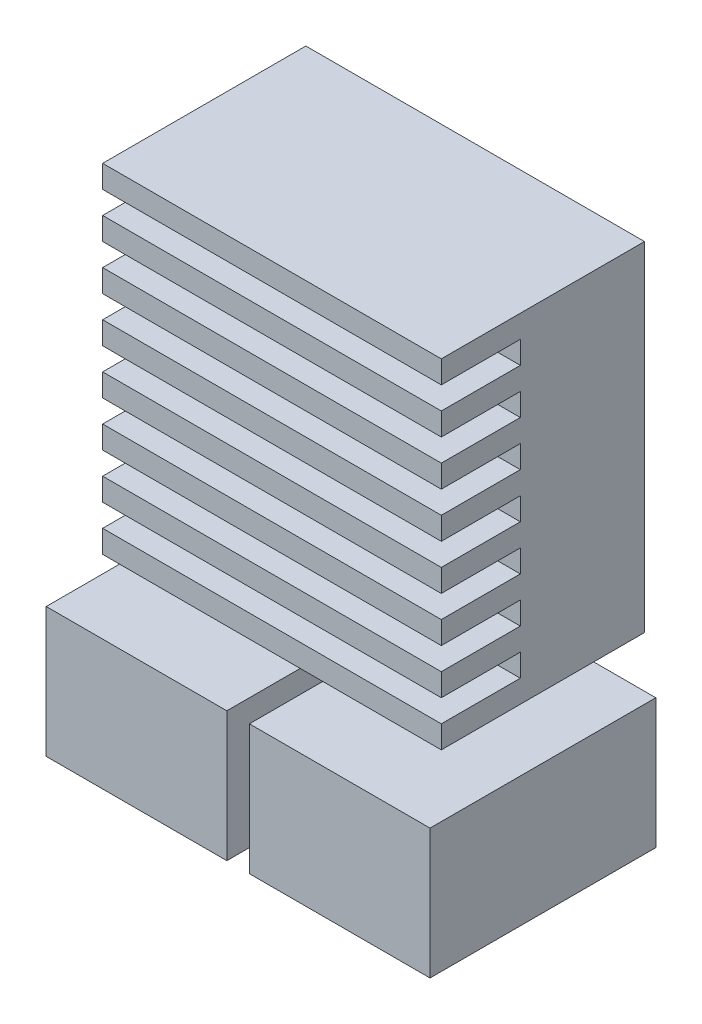
from build123d import *

# Parameters (mm, degrees)
SKICA1_W                 = 30
SKICA1_H                 = 30
SKICA1_R                 = 1.5
P_IDAT_VYSUNUT_M1_DEPTH  = 7
SKICA2_W                 = 30
SKICA2_H                 = 30
P_IDAT_VYSUNUT_M2_DEPTH  = 11
SKICA3_W                 = 7
SKICA3_H                 = 2
ODEBRAT_VYSUNUT_M1_DEPTH = 30
SKICA4_R                 = 1.5
P_IDAT_VYSUNUT_M3_DEPTH  = 3.5
SKICA5_W                 = 16
SKICA5_H                 = 20
P_IDAT_VYSUNUT_M4_DEPTH  = 11.5
P_IDAT_VYSUNUT_M5_DEPTH  = 6.5
ZKOSEN_1_SIZE            = 3


with BuildPart() as part:
    # Skica1 → Přidat vysunutím1 (new body)
    with BuildSketch(Plane.XY):
        Rectangle(SKICA1_W, SKICA1_H)
        with Locations((5, 5)):
            Circle(SKICA1_R, mode=Mode.SUBTRACT)
        with Locations((-5, 5)):
            Circle(SKICA1_R, mode=Mode.SUBTRACT)
        with Locations((0, -5)):
            Circle(SKICA1_R, mode=Mode.SUBTRACT)
    extrude(amount=P_IDAT_VYSUNUT_M1_DEPTH)

    # Skica2 → Přidat vysunutím2 (add)
    with BuildSketch(Plane.XY.offset(7)):
        Rectangle(SKICA2_W, SKICA2_H)
    extrude(amount=P_IDAT_VYSUNUT_M2_DEPTH)

    # Skica3 → Odebrat vysunutím1 (cut)
    with BuildSketch(Plane(origin=(15, 0, 0), x_dir=(0, 0, -1), z_dir=(1, 0, 0))):
        with Locations((-14.5, 12)):
            Rectangle(SKICA3_W, SKICA3_H)
        with Locations((-14.5, 8)):
            Rectangle(SKICA3_W, SKICA3_H)
        with Locations((-14.5, 4)):
            Rectangle(SKICA3_W, SKICA3_H)
        with Locations((-14.5, 0)):
            Rectangle(SKICA3_W, SKICA3_H)
        with Locations((-14.5, -4)):
            Rectangle(SKICA3_W, SKICA3_H)
        with Locations((-14.5, -8)):
            Rectangle(SKICA3_W, SKICA3_H)
        with Locations((-14.5, -12)):
            Rectangle(SKICA3_W, SKICA3_H)
    extrude(amount=-ODEBRAT_VYSUNUT_M1_DEPTH, mode=Mode.SUBTRACT)

    # Skica4 → Přidat vysunutím3 (add)
    with BuildSketch(Plane.XZ.offset(15)):
        with Locations(Location((9, 6, 0), (0, 0, 180))):
            Circle(SKICA4_R)
        with Locations(Location((-9, 6, 0), (0, 0, 180))):
            Circle(SKICA4_R)
    extrude(amount=P_IDAT_VYSUNUT_M3_DEPTH)

    # Skica5 → Přidat vysunutím4 (add)
    with BuildSketch(Plane.XZ.offset(18.5)):
        with Locations((9, 11)):
            Rectangle(SKICA5_W, SKICA5_H)
        with Locations((-9, 11)):
            Rectangle(SKICA5_W, SKICA5_H)
    extrude(amount=P_IDAT_VYSUNUT_M4_DEPTH)

    # Skica6 → Přidat vysunutím5 (add)
    with BuildSketch(Plane.XZ.offset(30)):
        Polygon((-4.958548116, 6), (-6.979274058, 9.5), (-11.020725942, 9.5), (-13.041451884, 6), (-11.020725942, 2.5), (-6.979274058, 2.5), align=None)
        Polygon((6.979274058, 2.5), (4.958548116, 6), (6.979274058, 9.5), (11.020725942, 9.5), (13.041451884, 6), (11.020725942, 2.5), align=None)
    extrude(amount=P_IDAT_VYSUNUT_M5_DEPTH)

    # Zkosení1
    zkosen_1_edges = [part.edges().sort_by_distance(p)[0] for p in [
        (-5.968911087, -36.5, 4.25),
        (-5.968911087, -36.5, 7.75),
        (-9, -36.5, 9.5),
        (-12.031088913, -36.5, 7.75),
        (-12.031088913, -36.5, 4.25),
        (-9, -36.5, 2.5),
        (9, -36.5, 2.5),
        (12.031088913, -36.5, 4.25),
        (12.031088913, -36.5, 7.75),
        (9, -36.5, 9.5),
        (5.968911087, -36.5, 7.75),
        (5.968911087, -36.5, 4.25),
    ]]
    chamfer(zkosen_1_edges, length=ZKOSEN_1_SIZE)


solid = part.part
